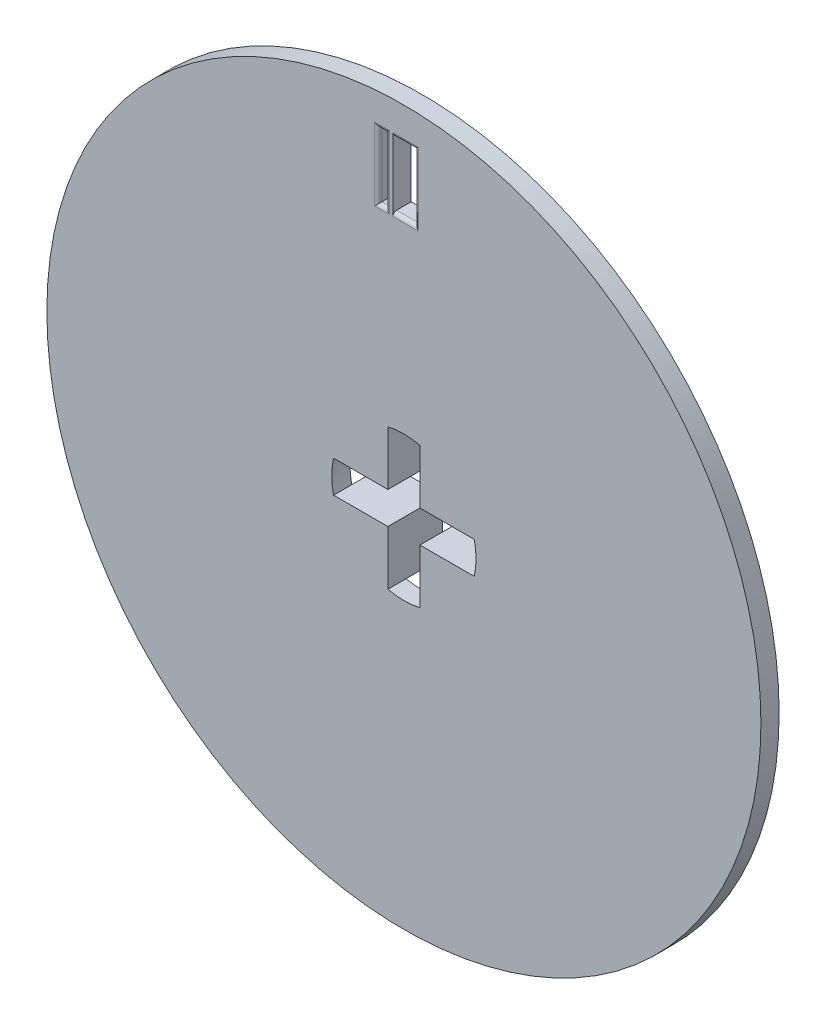
from build123d import *

# Parameters (mm, degrees)
SKETCH1_R             = 49
SKETCH1_W             = 1
SKETCH1_H             = 9
BOSS_EXTRUDE1_DEPTH   = 2.5
BOSS_EXTRUDE2_START   = -5
BOSS_EXTRUDE2_DEPTH   = 5
BOSS_EXTRUDE2_2_DEPTH = 5
BOSS_EXTRUDE2_3_DEPTH = 5
BOSS_EXTRUDE2_4_DEPTH = 5
FILLET1_R             = 0.5
BOSS_EXTRUDE4_DEPTH   = 2.5


with BuildPart() as part:
    # Sketch1 → Boss-Extrude1 (new body)
    with BuildSketch(Plane.XY):
        Circle(SKETCH1_R)
        with BuildLine():
            ThreePointArc((0, 9.9), (9.9, 0), (0, -9.9))
            ThreePointArc((0, -9.9), (-9.9, 0), (0, 9.9))
        make_face(mode=Mode.SUBTRACT)
        Polygon((-1.5, 35.5), (-1.5, 44.5), (1.5, 44.5), (1.5, 35.5), (0, 35.5), align=None, mode=Mode.SUBTRACT)
        with Locations((-3, 40)):
            Rectangle(SKETCH1_W, SKETCH1_H, mode=Mode.SUBTRACT)
    extrude(amount=BOSS_EXTRUDE1_DEPTH)

    # Fillet1
    fillet1_edges = [part.edges().sort_by_distance(p)[0] for p in [
        (-3, 44.5, 2.5),
        (-3, 35.5, 2.5),
        (-2.5, 40, 2.5),
        (-3.5, 40, 2.5),
        (0, 44.5, 2.5),
        (1.5, 40, 2.5),
        (0, 35.5, 2.5),
    ]]
    fillet(fillet1_edges, radius=FILLET1_R)



with BuildPart() as body_2:
    # Sketch1<3> → Boss-Extrude2 (new body)
    with BuildSketch(Plane.XY.offset(BOSS_EXTRUDE2_START)):
        with BuildLine():
            ThreePointArc((9.652460826, 2.2), (7.000357134, 7.000357134), (2.2, 9.652460826))
            Line((2.2, 9.652460826), (2.2, 2.2))
            Line((2.2, 2.2), (9.652460826, 2.2))
        make_face()
    extrude(amount=BOSS_EXTRUDE2_DEPTH)


with BuildPart() as body_3:
    # Sketch1<3> → Boss-Extrude2 2 (new body)
    with BuildSketch(Plane.XY.offset(BOSS_EXTRUDE2_START)):
        with BuildLine():
            Line((-2.2, 2.2), (-2.2, 9.652460826))
            ThreePointArc((-2.2, 9.652460826), (-7.000357134, 7.000357134), (-9.652460826, 2.2))
            Line((-9.652460826, 2.2), (-2.2, 2.2))
        make_face()
    extrude(amount=BOSS_EXTRUDE2_2_DEPTH)


with BuildPart() as body_4:
    # Sketch1<3> → Boss-Extrude2 3 (new body)
    with BuildSketch(Plane.XY.offset(BOSS_EXTRUDE2_START)):
        with BuildLine():
            Line((9.652460826, -2.2), (2.2, -2.2))
            Line((2.2, -2.2), (2.2, -9.652460826))
            ThreePointArc((2.2, -9.652460826), (7.000357134, -7.000357134), (9.652460826, -2.2))
        make_face()
    extrude(amount=BOSS_EXTRUDE2_3_DEPTH)


with BuildPart() as body_5:
    # Sketch1<3> → Boss-Extrude2 4 (new body)
    with BuildSketch(Plane.XY.offset(BOSS_EXTRUDE2_START)):
        with BuildLine():
            Line((-2.2, -9.652460826), (-2.2, -2.2))
            Line((-2.2, -2.2), (-9.652460826, -2.2))
            ThreePointArc((-9.652460826, -2.2), (-7.000357134, -7.000357134), (-2.2, -9.652460826))
        make_face()
    extrude(amount=BOSS_EXTRUDE2_4_DEPTH)


with BuildPart() as part_1:
    add(part.part)

    add(body_2.part)  # Boss-Extrude4 merges body 2

    add(body_3.part)  # Boss-Extrude4 merges body 3

    add(body_4.part)  # Boss-Extrude4 merges body 4

    add(body_5.part)  # Boss-Extrude4 merges body 5
    # Sketch3 → Boss-Extrude4 (add)
    with BuildSketch(Plane.XY):
        with BuildLine():
            Line((-2.2, 2.2), (-2.2, 9.652460826))
            ThreePointArc((-2.2, 9.652460826), (-7.000357134, 7.000357134), (-9.652460826, 2.2))
            Line((-9.652460826, 2.2), (-2.2, 2.2))
        make_face()
        with BuildLine():
            Line((-2.2, -2.2), (-9.652460826, -2.2))
            ThreePointArc((-9.652460826, -2.2), (-7.000357134, -7.000357134), (-2.2, -9.652460826))
            Line((-2.2, -9.652460826), (-2.2, -2.2))
        make_face()
        with BuildLine():
            Line((2.2, -2.2), (2.2, -9.652460826))
            ThreePointArc((2.2, -9.652460826), (7.000357134, -7.000357134), (9.652460826, -2.2))
            Line((9.652460826, -2.2), (2.2, -2.2))
        make_face()
        with BuildLine():
            Line((2.2, 2.2), (9.652460826, 2.2))
            ThreePointArc((9.652460826, 2.2), (7.000357134, 7.000357134), (2.2, 9.652460826))
            Line((2.2, 9.652460826), (2.2, 2.2))
        make_face()
    extrude(amount=BOSS_EXTRUDE4_DEPTH)


solid = part_1.part
